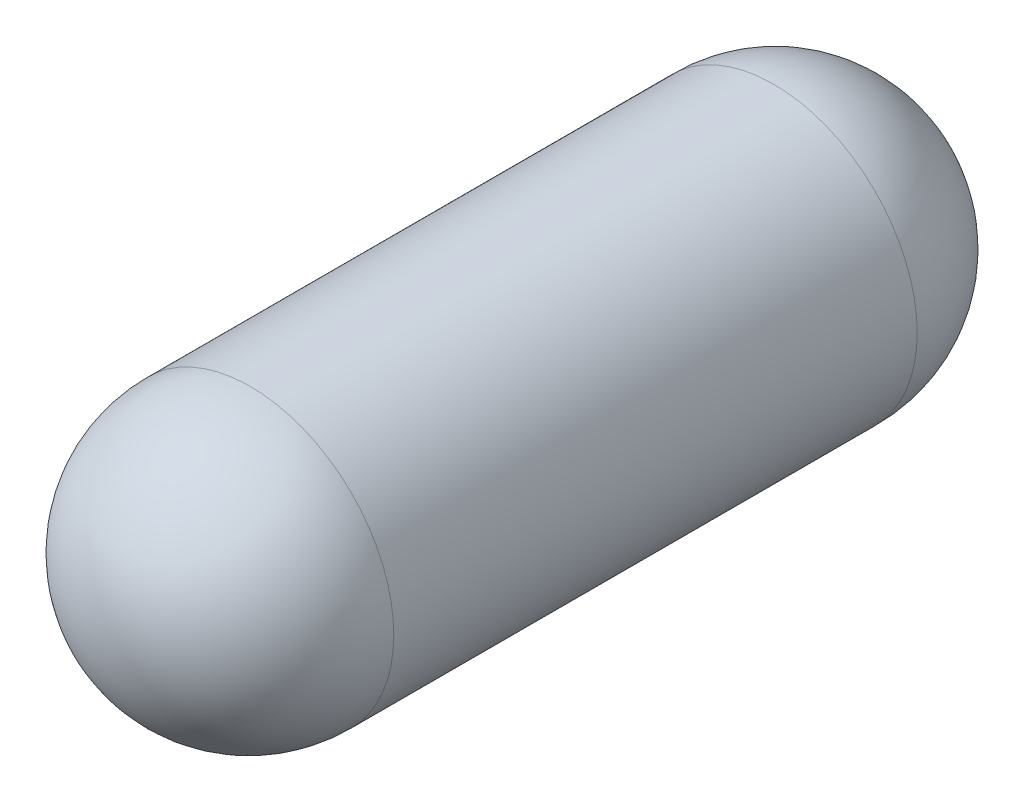
from build123d import *

# Parameters (mm, degrees)
SKETCH1_R           = 48.73625
BOSS_EXTRUDE1_DEPTH = 177.8
DOME1_FACE_RADIUS   = 48.73625
DOME1_HEIGHT        = 49.2125
DOME2_FACE_RADIUS   = 48.73625
DOME2_HEIGHT        = 49.2125


with BuildPart() as part:
    # Sketch1 → Boss-Extrude1 (new body)
    with BuildSketch(Plane.XY):
        Circle(SKETCH1_R)
    extrude(amount=BOSS_EXTRUDE1_DEPTH)

    # Dome1: a dome of height H over a round flat face of radius A is a cap of a sphere of radius (A * A + H * H) / (2 * H)
    dome1_r = (DOME1_FACE_RADIUS * DOME1_FACE_RADIUS + DOME1_HEIGHT * DOME1_HEIGHT) / (2 * DOME1_HEIGHT)
    dome1_base = Plane((0, 0, 177.8), z_dir=(0, 0, 1))
    with Locations(dome1_base.offset(DOME1_HEIGHT - dome1_r)):
        dome1_ball = Sphere(dome1_r, mode=Mode.PRIVATE)
    add(split(dome1_ball, bisect_by=dome1_base, keep=Keep.TOP, mode=Mode.PRIVATE))

    # Dome2: a dome of height H over a round flat face of radius A is a cap of a sphere of radius (A * A + H * H) / (2 * H)
    dome2_r = (DOME2_FACE_RADIUS * DOME2_FACE_RADIUS + DOME2_HEIGHT * DOME2_HEIGHT) / (2 * DOME2_HEIGHT)
    dome2_base = Plane((0, 0, 0), z_dir=(0, 0, -1))
    with Locations(dome2_base.offset(DOME2_HEIGHT - dome2_r)):
        dome2_ball = Sphere(dome2_r, mode=Mode.PRIVATE)
    add(split(dome2_ball, bisect_by=dome2_base, keep=Keep.TOP, mode=Mode.PRIVATE))


solid = part.part
